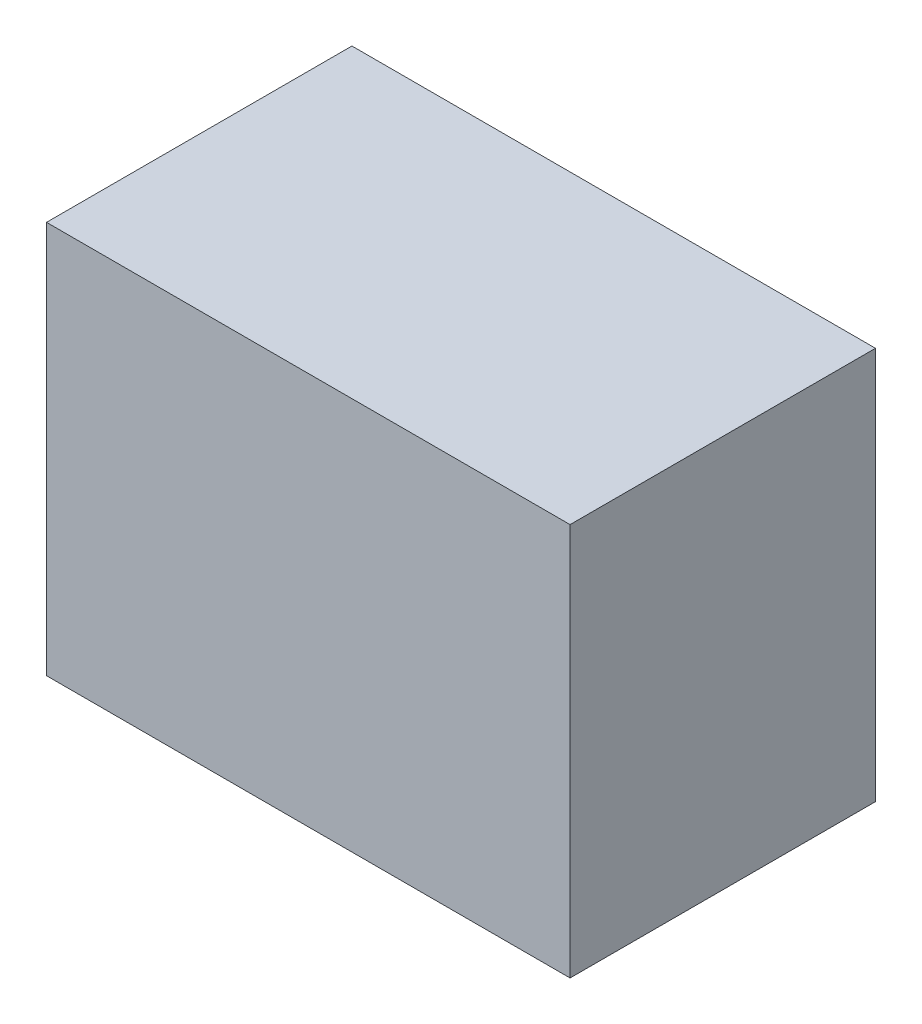
from build123d import *

# Parameters (mm, degrees)
SKETCH1_W           = 304.8
SKETCH1_H           = 177.8
BOSS_EXTRUDE1_DEPTH = 228.6
SKETCH2_W           = 6.35
SKETCH2_H           = 29.137469297


with BuildPart() as part:
    # Sketch1 → Boss-Extrude1 (new body)
    with BuildSketch(Plane(origin=(0, 0, 0), x_dir=(1, 0, 0), z_dir=(0, 1, 0))):
        Rectangle(SKETCH1_W, SKETCH1_H)
    extrude(amount=BOSS_EXTRUDE1_DEPTH)

    # Sketch2 → Revolve1 (revolve)
    with BuildSketch(Plane(origin=(0, 152.4, 0), x_dir=(1, 0, 0), z_dir=(0, 1, 0))):
        with Locations((-155.575, 14.568734649)):
            Rectangle(SKETCH2_W, SKETCH2_H)
    revolve(axis=Axis((-152.4, 152.4, 0), (-1, 0, 0)))


solid = part.part
